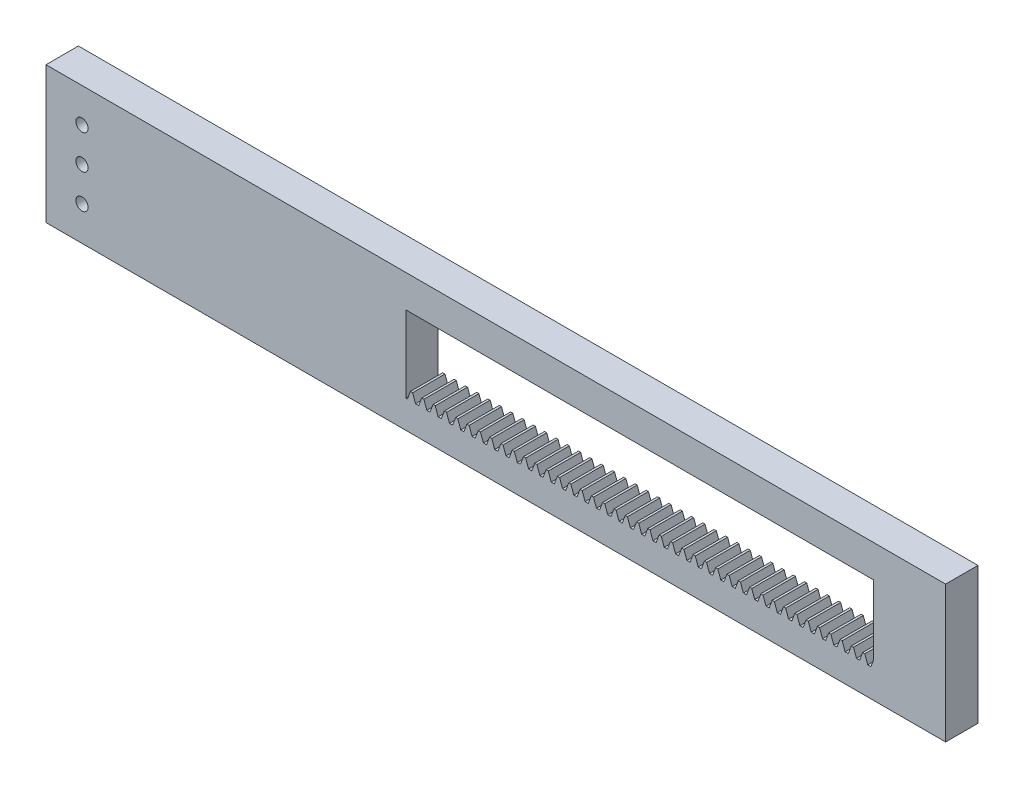
from build123d import *

# Parameters (mm, degrees)
BLANKSKE_W          = 130
BLANKSKE_H          = 10
BLANK_DEPTH         = 9
TOOTHCUTSIM_DEPTH   = 131.694299799
TEETHCUTS_COUNT     = 91
TEETHCUTS_PITCH     = 3.14159265
SKETCH2_W           = 20
SKETCH2_H           = 9
BOSS_EXTRUDE1_DEPTH = 29
SKETCH3_W           = 9
SKETCH3_H           = 9
BOSS_EXTRUDE2_DEPTH = 20
SKETCH3_2_W         = 9
SKETCH3_2_H         = 9
BOSS_EXTRUDE3_DEPTH = 130
SKETCH4_W           = 9
SKETCH4_H           = 38
BOSS_EXTRUDE4_DEPTH = 100
SKETCH5_R           = 1.7
CUT_EXTRUDE1_DEPTH  = 10


with BuildPart() as part:
    # BlankSke → Blank (new body)
    with BuildSketch(Plane.XY):
        with Locations((65, 5)):
            Rectangle(BLANKSKE_W, BLANKSKE_H)
    extrude(amount=-BLANK_DEPTH)

    # TooCutSkeSim → ToothCutSim (cut, through all)
    with BuildSketch(Plane.XY):
        Polygon((0.44443537, 7.75), (-0.44443537, 7.75), (-1.272613241, 10.0254), (1.272613241, 10.0254), align=None)
    toothcutsim = extrude(amount=-TOOTHCUTSIM_DEPTH, mode=Mode.SUBTRACT)

    # TeethCuts: ToothCutSim ×91
    with Locations(*[(i * TEETHCUTS_PITCH, 0, 0) for i in range(1, TEETHCUTS_COUNT)]):
        add(toothcutsim, mode=Mode.SUBTRACT)

    # Sketch2 → Boss-Extrude1 (add)
    with BuildSketch(Plane.XZ):
        with Locations((140, -4.5)):
            Rectangle(SKETCH2_W, SKETCH2_H)
    extrude(amount=-BOSS_EXTRUDE1_DEPTH)

    # Sketch3 → Boss-Extrude2 (add)
    with BuildSketch(Plane.ZY.offset(-130)):
        with Locations((-4.5, 33.5)):
            Rectangle(SKETCH3_W, SKETCH3_H)
    extrude(amount=-BOSS_EXTRUDE2_DEPTH)

    # Sketch3<2> → Boss-Extrude3 (add)
    with BuildSketch(Plane.ZY.offset(-130)):
        with Locations((-4.5, 33.5)):
            Rectangle(SKETCH3_2_W, SKETCH3_2_H)
    extrude(amount=BOSS_EXTRUDE3_DEPTH)

    # Sketch4 → Boss-Extrude4 (add)
    with BuildSketch(Plane.ZY):
        with Locations((-4.5, 19)):
            Rectangle(SKETCH4_W, SKETCH4_H)
    extrude(amount=BOSS_EXTRUDE4_DEPTH)

    # Sketch5 → Cut-Extrude1 (cut)
    with BuildSketch(Plane(origin=(0, 0, -9), x_dir=(-1, 0, 0), z_dir=(0, 0, -1))):
        with Locations((90, 19)):
            Circle(SKETCH5_R)
        with Locations((90, 9.5)):
            Circle(SKETCH5_R)
        with Locations((90, 28.5)):
            Circle(SKETCH5_R)
    extrude(amount=-CUT_EXTRUDE1_DEPTH, mode=Mode.SUBTRACT)


solid = part.part
